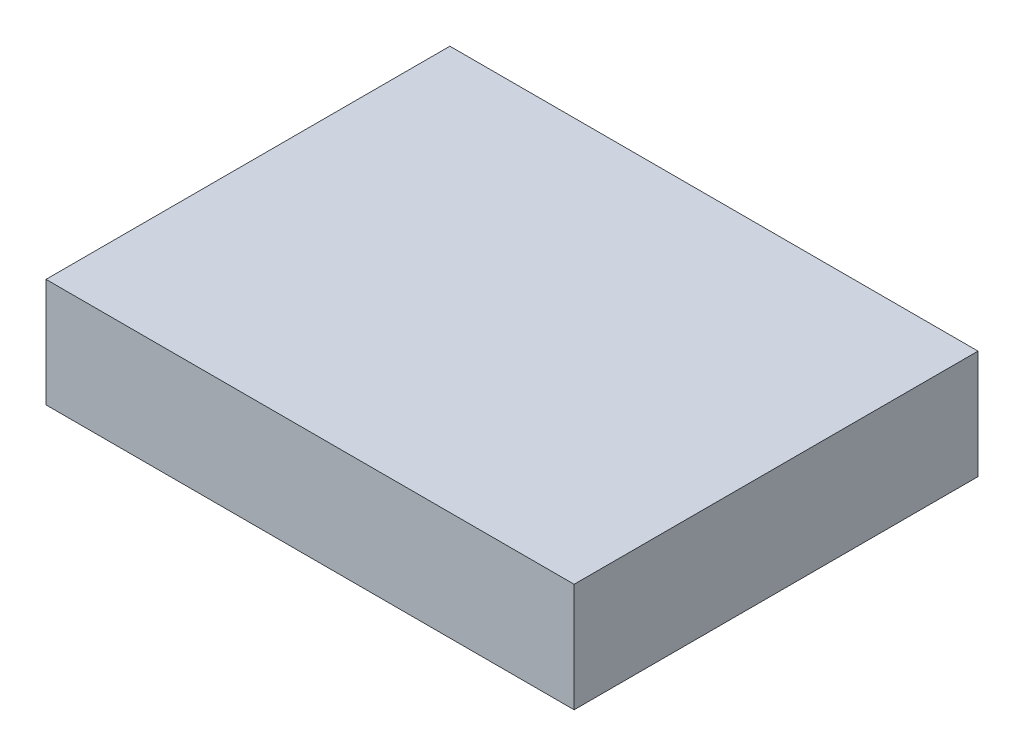
from build123d import *

# Parameters (mm, degrees)
SKETCH1_W           = 43.18
SKETCH1_H           = 33.02
BOSS_EXTRUDE1_DEPTH = 8.89


with BuildPart() as part:
    # Sketch1 → Boss-Extrude1 (new body)
    with BuildSketch(Plane(origin=(0, 0, 0), x_dir=(1, 0, 0), z_dir=(0, 1, 0))):
        Rectangle(SKETCH1_W, SKETCH1_H)
    extrude(amount=BOSS_EXTRUDE1_DEPTH)


solid = part.part
